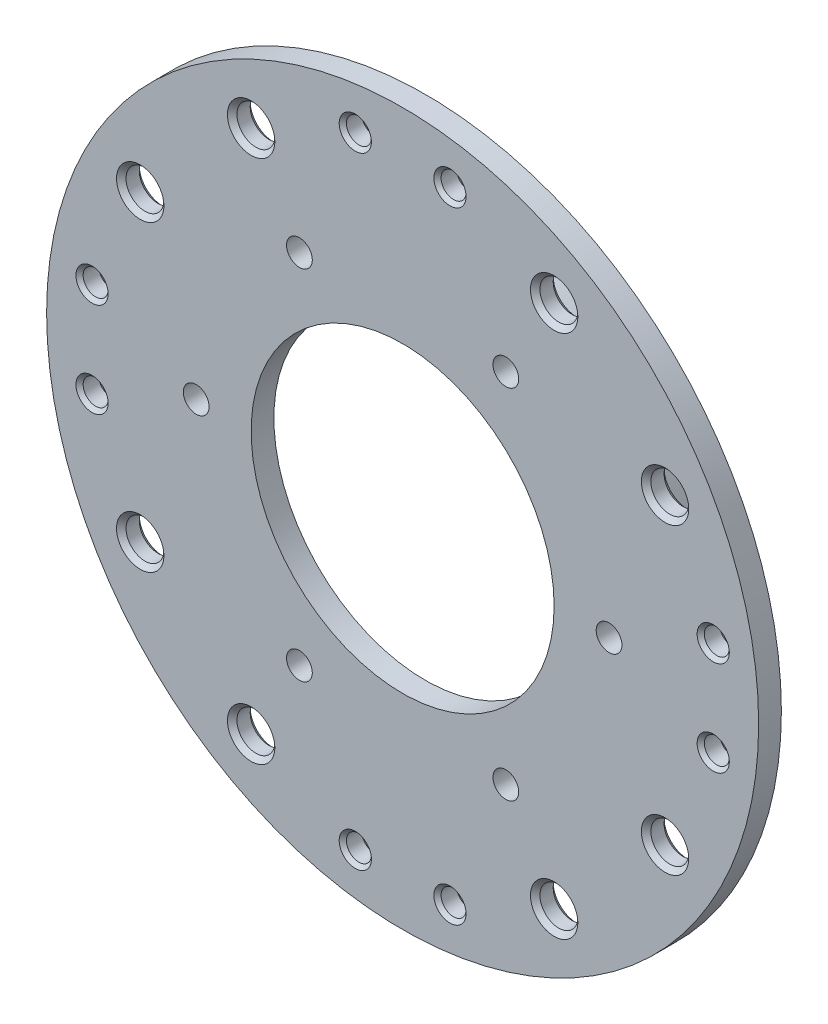
from build123d import *

# Parameters (mm, degrees)
BOSS_EXTRU_1_START             = 0.6
ESQUISSE1_R                    = 47
ESQUISSE1_R_2                  = 20
BOSS_EXTRU_1_DEPTH             = 3
ESQUISSE2_R                    = 34.05
ESQUISSE2_R_2                  = 31.05
BOSS_EXTRU_2_DEPTH             = 8
CHANFREIN1_SIZE                = 0.5
TROU_TARAUD_M4X0_71_AT_2_COUNT = 2
TROU_TARAUD_M4X0_71_AT_2_PITCH = 12.5
TROU_TARAUD_M4X0_71_AT_3_COUNT = 2
TROU_TARAUD_M4X0_71_AT_3_PITCH = 82
TROU_TARAUD_M4X0_71_AT_4_COUNT = 2
TROU_TARAUD_M4X0_71_AT_4_PITCH = 82.947272408
TROU_TARAUD_M4X0_71_AT_5_COUNT = 2
TROU_TARAUD_M4X0_71_AT_5_PITCH = 49.143921292
TROU_TARAUD_M4X0_71_AT_6_COUNT = 2
TROU_TARAUD_M4X0_71_AT_6_PITCH = 58.652578801
TROU_TARAUD_M4X0_71_AT_7_COUNT = 2
TROU_TARAUD_M4X0_71_AT_7_PITCH = 66.821590822
TROU_TARAUD_M4X0_71_AT_8_COUNT = 2
TROU_TARAUD_M4X0_71_AT_8_PITCH = 58.652578801
TROU_TARAUD_M6X1_01_AT_2_COUNT = 2
TROU_TARAUD_M6X1_01_AT_2_PITCH = 20.705523608
TROU_TARAUD_M6X1_01_AT_3_COUNT = 2
TROU_TARAUD_M6X1_01_AT_3_PITCH = 56.568542495
TROU_TARAUD_M6X1_01_AT_4_COUNT = 2
TROU_TARAUD_M6X1_01_AT_4_PITCH = 69.282032303
TROU_TARAUD_M6X1_01_AT_5_COUNT = 2
TROU_TARAUD_M6X1_01_AT_5_PITCH = 80
TROU_TARAUD_M6X1_01_AT_6_COUNT = 2
TROU_TARAUD_M6X1_01_AT_6_PITCH = 77.274066103
TROU_TARAUD_M6X1_01_AT_7_COUNT = 2
TROU_TARAUD_M6X1_01_AT_7_PITCH = 56.568542495
TROU_TARAUD_M6X1_01_AT_8_COUNT = 2
TROU_TARAUD_M6X1_01_AT_8_PITCH = 40
D_GAGEMENT_M31_D               = 3.4


with BuildPart() as part:
    # Esquisse1 → Boss.-Extru.1 (new body)
    with BuildSketch(Plane.XY.offset(BOSS_EXTRU_1_START)):
        Circle(ESQUISSE1_R)
        Circle(ESQUISSE1_R_2, mode=Mode.SUBTRACT)
    extrude(amount=BOSS_EXTRU_1_DEPTH)

    # Esquisse2 → Boss.-Extru.2 (add)
    with BuildSketch(Plane(origin=(0, 0, 0.6), x_dir=(-1, 0, 0), z_dir=(0, 0, -1))):
        with Locations(Location((0, 0, 0), (0, 0, 180))):
            Circle(ESQUISSE2_R)
        Circle(ESQUISSE2_R_2, mode=Mode.SUBTRACT)
    extrude(amount=BOSS_EXTRU_2_DEPTH)

    # Chanfrein1
    chanfrein1_edges = [part.edges().sort_by_distance(p)[0] for p in [
        (-34.05, 0, -7.4),
        (31.05, 0, -7.4),
    ]]
    chamfer(chanfrein1_edges, length=CHANFREIN1_SIZE)

    # Esquisse15 → Trou taraudé M4x0.71 (revolve, cut)
    with BuildSketch(Plane(origin=(6.25, 41, 3.6), x_dir=(0, -1, 0), z_dir=(1, 0, 0))):
        Polygon((0, 0), (0, 3), (2.125, 3), (1.65, 2.525), (1.65, 0.475), (2.125, 0), align=None)
    trou_taraud_m4x0_71 = revolve(axis=Axis((6.25, 41, 9.95), (0, 0, -1)), mode=Mode.SUBTRACT)

    # Trou taraudé M4x0.71 at 2: Trou taraudé M4x0.71 ×2
    with Locations(*[(-i * TROU_TARAUD_M4X0_71_AT_2_PITCH, 0, 0) for i in range(1, TROU_TARAUD_M4X0_71_AT_2_COUNT)]):
        add(trou_taraud_m4x0_71, mode=Mode.SUBTRACT)

    # Trou taraudé M4x0.71 at 3: Trou taraudé M4x0.71 ×2
    with Locations(*[(0, -i * TROU_TARAUD_M4X0_71_AT_3_PITCH, 0) for i in range(1, TROU_TARAUD_M4X0_71_AT_3_COUNT)]):
        add(trou_taraud_m4x0_71, mode=Mode.SUBTRACT)

    # Trou taraudé M4x0.71 at 4: Trou taraudé M4x0.71 ×2
    with Locations(*[Vector(-0.15069814397812628, -0.9885798244965087, 0) * (i * TROU_TARAUD_M4X0_71_AT_4_PITCH) for i in range(1, TROU_TARAUD_M4X0_71_AT_4_COUNT)]):
        add(trou_taraud_m4x0_71, mode=Mode.SUBTRACT)

    # Trou taraudé M4x0.71 at 5: Trou taraudé M4x0.71 ×2
    with Locations(*[Vector(0.7071067811865477, -0.7071067811865474, 0) * (i * TROU_TARAUD_M4X0_71_AT_5_PITCH) for i in range(1, TROU_TARAUD_M4X0_71_AT_5_COUNT)]):
        add(trou_taraud_m4x0_71, mode=Mode.SUBTRACT)

    # Trou taraudé M4x0.71 at 6: Trou taraudé M4x0.71 ×2
    with Locations(*[Vector(0.5924718181265287, -0.8055911771648481, 0) * (i * TROU_TARAUD_M4X0_71_AT_6_PITCH) for i in range(1, TROU_TARAUD_M4X0_71_AT_6_COUNT)]):
        add(trou_taraud_m4x0_71, mode=Mode.SUBTRACT)

    # Trou taraudé M4x0.71 at 7: Trou taraudé M4x0.71 ×2
    with Locations(*[Vector(-0.7071067811865475, -0.7071067811865477, 0) * (i * TROU_TARAUD_M4X0_71_AT_7_PITCH) for i in range(1, TROU_TARAUD_M4X0_71_AT_7_COUNT)]):
        add(trou_taraud_m4x0_71, mode=Mode.SUBTRACT)

    # Trou taraudé M4x0.71 at 8: Trou taraudé M4x0.71 ×2
    with Locations(*[Vector(-0.8055911771648481, -0.5924718181265287, 0) * (i * TROU_TARAUD_M4X0_71_AT_8_PITCH) for i in range(1, TROU_TARAUD_M4X0_71_AT_8_COUNT)]):
        add(trou_taraud_m4x0_71, mode=Mode.SUBTRACT)

    # Esquisse17 → Trou taraudé M6x1.01 (revolve, cut)
    with BuildSketch(Plane(origin=(34.641016151, 20, 0.6), x_dir=(0, 1, 0), z_dir=(1, 0, 0))):
        Polygon((0, 0), (0, 3), (3.125, 3), (2.5, 2.375), (2.5, 0.625), (3.125, 0), align=None)
    trou_taraud_m6x1_01 = revolve(axis=Axis((34.641016151, 20, -5.75), (0, 0, 1)), mode=Mode.SUBTRACT)

    # Trou taraudé M6x1.01 at 2: Trou taraudé M6x1.01 ×2
    with Locations(*[Vector(-0.7071067811865414, 0.7071067811865538, 0) * (i * TROU_TARAUD_M6X1_01_AT_2_PITCH) for i in range(1, TROU_TARAUD_M6X1_01_AT_2_COUNT)]):
        add(trou_taraud_m6x1_01, mode=Mode.SUBTRACT)

    # Trou taraudé M6x1.01 at 3: Trou taraudé M6x1.01 ×2
    with Locations(*[Vector(-0.9659258262890666, 0.25881904510252685, 0) * (i * TROU_TARAUD_M6X1_01_AT_3_PITCH) for i in range(1, TROU_TARAUD_M6X1_01_AT_3_COUNT)]):
        add(trou_taraud_m6x1_01, mode=Mode.SUBTRACT)

    # Trou taraudé M6x1.01 at 4: Trou taraudé M6x1.01 ×2
    with Locations(*[(-i * TROU_TARAUD_M6X1_01_AT_4_PITCH, 0, 0) for i in range(1, TROU_TARAUD_M6X1_01_AT_4_COUNT)]):
        add(trou_taraud_m6x1_01, mode=Mode.SUBTRACT)

    # Trou taraudé M6x1.01 at 5: Trou taraudé M6x1.01 ×2
    with Locations(*[Vector(-0.8660254037844417, -0.49999999999999467, 0) * (i * TROU_TARAUD_M6X1_01_AT_5_PITCH) for i in range(1, TROU_TARAUD_M6X1_01_AT_5_COUNT)]):
        add(trou_taraud_m6x1_01, mode=Mode.SUBTRACT)

    # Trou taraudé M6x1.01 at 6: Trou taraudé M6x1.01 ×2
    with Locations(*[Vector(-0.7071067811865456, -0.7071067811865496, 0) * (i * TROU_TARAUD_M6X1_01_AT_6_PITCH) for i in range(1, TROU_TARAUD_M6X1_01_AT_6_COUNT)]):
        add(trou_taraud_m6x1_01, mode=Mode.SUBTRACT)

    # Trou taraudé M6x1.01 at 7: Trou taraudé M6x1.01 ×2
    with Locations(*[Vector(-0.25881904510252607, -0.9659258262890669, 0) * (i * TROU_TARAUD_M6X1_01_AT_7_PITCH) for i in range(1, TROU_TARAUD_M6X1_01_AT_7_COUNT)]):
        add(trou_taraud_m6x1_01, mode=Mode.SUBTRACT)

    # Trou taraudé M6x1.01 at 8: Trou taraudé M6x1.01 ×2
    with Locations(*[(0, -i * TROU_TARAUD_M6X1_01_AT_8_PITCH, 0) for i in range(1, TROU_TARAUD_M6X1_01_AT_8_COUNT)]):
        add(trou_taraud_m6x1_01, mode=Mode.SUBTRACT)

    # Dégagement M31 (through all)
    with Locations(Plane(origin=(27.25, 0, 3.6), x_dir=(1, 0, 0), z_dir=(0, 0, 1))):
        with Locations((0, 0), (-13.625, 23.599192253), (-40.875, 23.599192253), (-54.5, 0), (-40.875, -23.599192253), (-13.625, -23.599192253)):
            Hole(D_GAGEMENT_M31_D / 2)


solid = part.part
